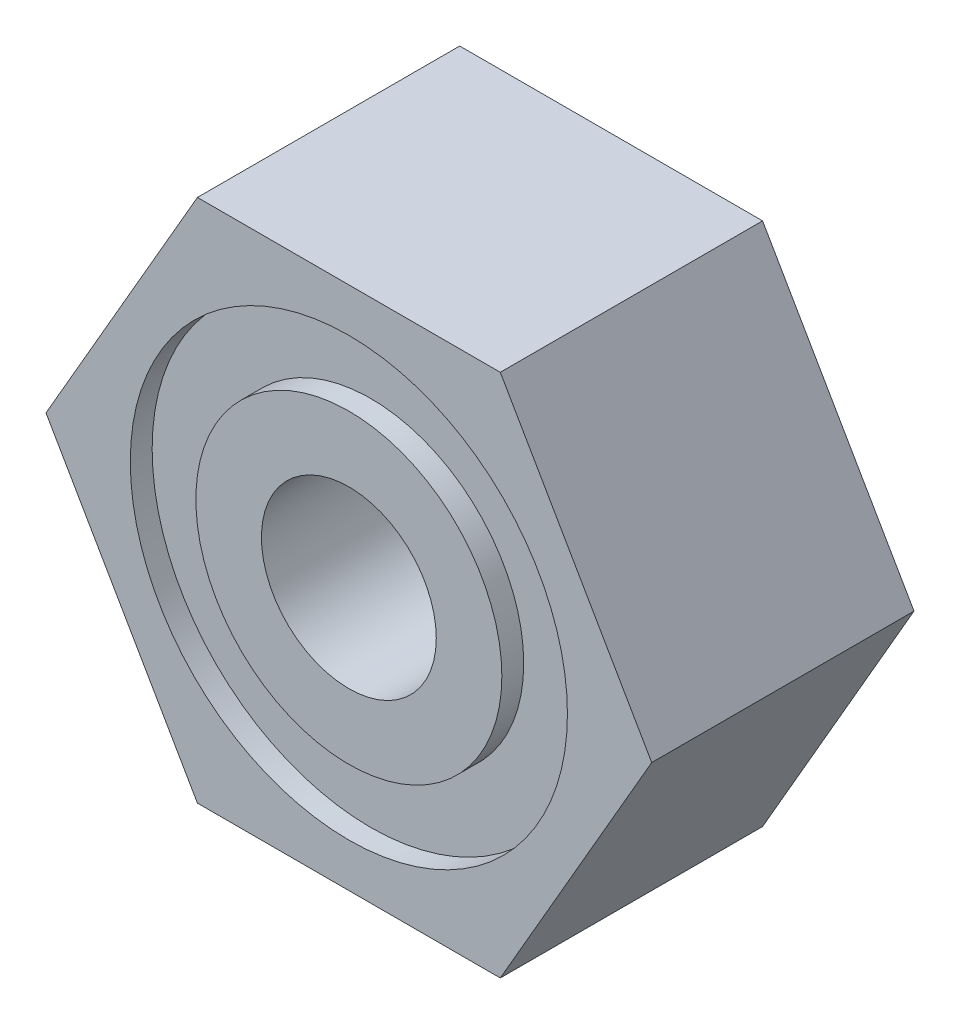
from build123d import *

# Parameters (mm, degrees)
SKETCH_1_R          = 2
EXTRUDE_1_DEPTH     = 6
SKETCH_2_R          = 5
SKETCH_2_R_2        = 3.5
CUT_EXTRUDE_1_DEPTH = 0.5
SKETCH_3_R          = 1
CUT_EXTRUDE_2_DEPTH = 5.5


with BuildPart() as part:
    # 草图1 → 凸台-拉伸1 (new body)
    with BuildSketch(Plane.XY):
        Polygon((3.464101615, -6), (6.92820323, 0), (3.464101615, 6), (-3.464101615, 6), (-6.92820323, 0), (-3.464101615, -6), align=None)
        Circle(SKETCH_1_R, mode=Mode.SUBTRACT)
    extrude(amount=EXTRUDE_1_DEPTH)

    # 草图2 → 切除-拉伸1 (cut)
    with BuildSketch(Plane.XY.offset(6)):
        Circle(SKETCH_2_R)
        Circle(SKETCH_2_R_2, mode=Mode.SUBTRACT)
    extrude(amount=-CUT_EXTRUDE_1_DEPTH, mode=Mode.SUBTRACT)

    # 草图3 → 切除-拉伸2 (cut, symmetric)
    with BuildSketch(Plane(origin=(0, 0, 0), x_dir=(-0.8660254037844387, -0.49999999999999983, 0), z_dir=(0.49999999999999983, -0.8660254037844387, 0))):
        Circle(SKETCH_3_R)
    extrude(amount=CUT_EXTRUDE_2_DEPTH, both=True, mode=Mode.SUBTRACT)


solid = part.part
